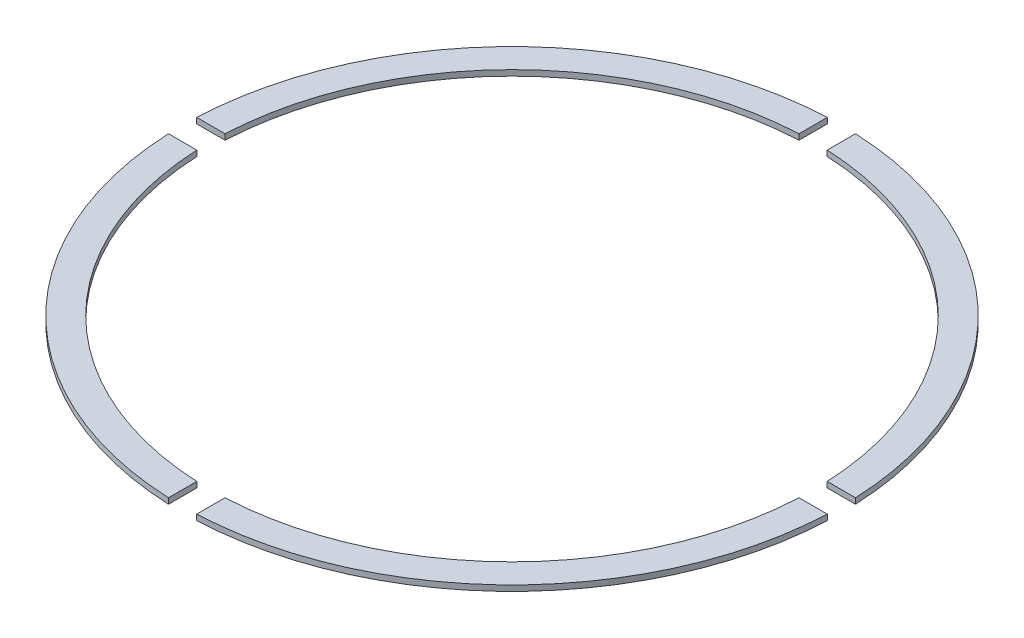
from build123d import *

# Parameters (mm, degrees)
SKETCH1_R           = 175
SKETCH1_R_2         = 160
BOSS_EXTRUDE1_DEPTH = 1.5
SKETCH2_W           = 32.609126468
SKETCH2_H           = 15
AXIS_GAP_DEPTH      = 248.49191906
CIRPATTERN1_COUNT   = 4


with BuildPart() as part:
    # Sketch1 → Boss-Extrude1 (new, symmetric)
    with BuildSketch(Plane(origin=(0, 0, 0), x_dir=(1, 0, 0), z_dir=(0, 1, 0))):
        with Locations(Location((0, 0, 0), (0, 0, 270))):
            Circle(SKETCH1_R)
        with Locations(Location((0, 0, 0), (0, 0, 270))):
            Circle(SKETCH1_R_2, mode=Mode.SUBTRACT)
    extrude(amount=BOSS_EXTRUDE1_DEPTH, both=True)

    # Sketch2 → axis gap (cut, symmetric)
    with BuildSketch(Plane(origin=(0, 0, 0), x_dir=(1, 0, 0), z_dir=(0, 1, 0))):
        with Locations((167.5, 0)):
            Rectangle(SKETCH2_W, SKETCH2_H)
    axis_gap = extrude(amount=AXIS_GAP_DEPTH, both=True, mode=Mode.SUBTRACT)

    # CirPattern1: axis gap ×4 about axis
    cirpattern1_axis = Axis((0, 0, 0), (0, 1, 0))
    for i in range(1, CIRPATTERN1_COUNT):
        add(axis_gap.rotate(cirpattern1_axis, i * 360 / CIRPATTERN1_COUNT), mode=Mode.SUBTRACT)


solid = part.part
